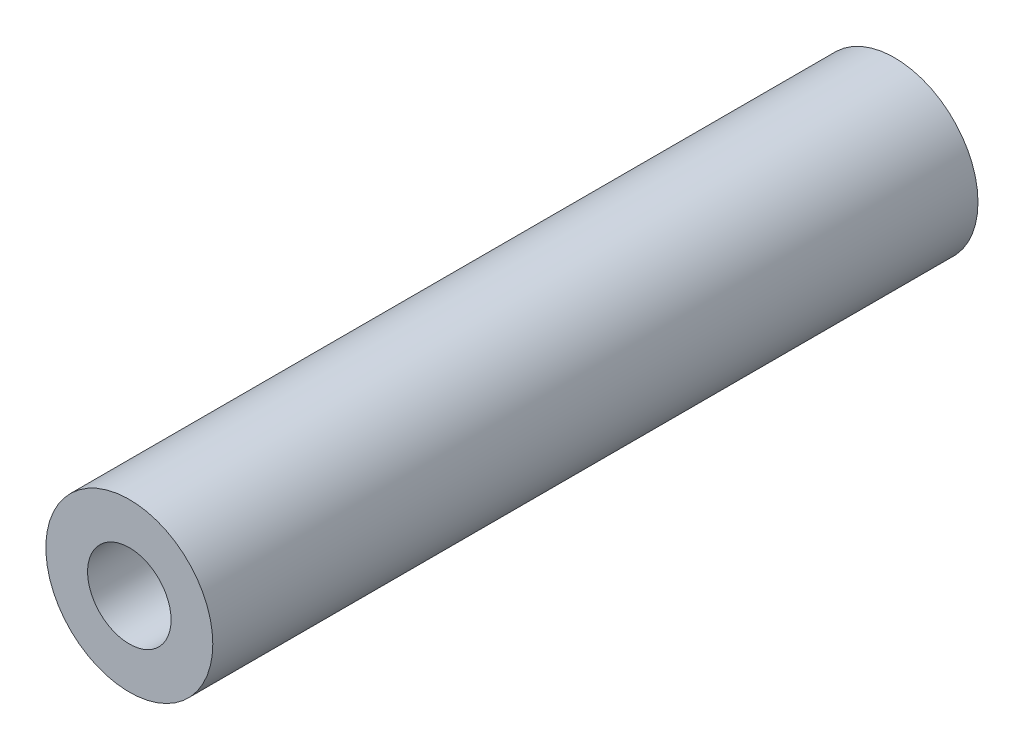
from build123d import *

# Parameters (mm, degrees)
SKETCH1_R           = 6
BOSS_EXTRUDE1_DEPTH = 55
SKETCH2_R           = 3
CUT_EXTRUDE1_DEPTH  = 14
SKETCH3_R           = 3.5
CUT_EXTRUDE2_DEPTH  = 14


with BuildPart() as part:
    # Sketch1 → Boss-Extrude1 (new body)
    with BuildSketch(Plane.XY):
        Circle(SKETCH1_R)
    extrude(amount=BOSS_EXTRUDE1_DEPTH)

    # Sketch2 → Cut-Extrude1 (cut)
    with BuildSketch(Plane.XY.offset(55)):
        Circle(SKETCH2_R)
    extrude(amount=-CUT_EXTRUDE1_DEPTH, mode=Mode.SUBTRACT)

    # Sketch3 → Cut-Extrude2 (cut)
    with BuildSketch(Plane(origin=(0, 0, 0), x_dir=(-1, 0, 0), z_dir=(0, 0, -1))):
        Circle(SKETCH3_R)
    extrude(amount=-CUT_EXTRUDE2_DEPTH, mode=Mode.SUBTRACT)


solid = part.part
